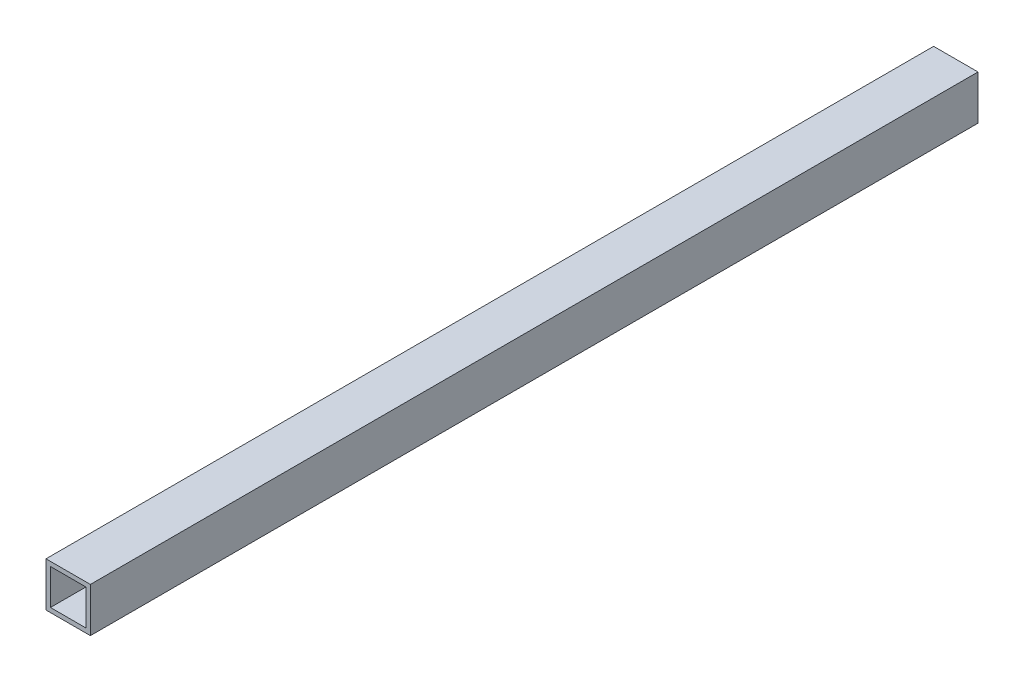
from build123d import *

# Parameters (mm, degrees)
SKETCH_1_W      = 15
SKETCH_1_H      = 15
SKETCH_1_W_2    = 12
SKETCH_1_H_2    = 12
EXTRUDE_1_DEPTH = 300


with BuildPart() as part:
    # 草图1 → 拉伸-薄壁1 (new body)
    with BuildSketch(Plane.XY):
        Rectangle(SKETCH_1_W, SKETCH_1_H)
        Rectangle(SKETCH_1_W_2, SKETCH_1_H_2, mode=Mode.SUBTRACT)
    extrude(amount=EXTRUDE_1_DEPTH)


solid = part.part
